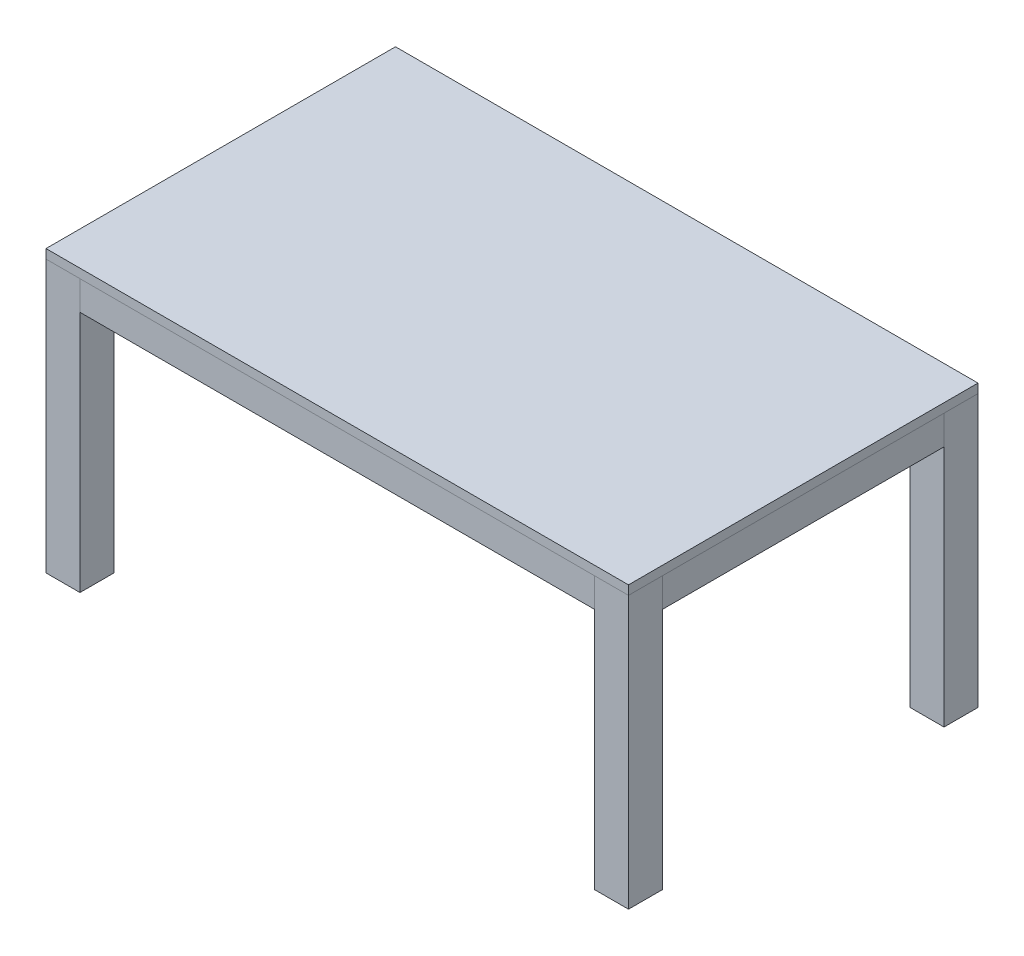
from build123d import *

# Parameters (mm, degrees)
SKETCH1_W             = 88.9
SKETCH1_H             = 88.9
BOSS_EXTRUDE1_DEPTH   = 711.2
BOSS_EXTRUDE1_2_DEPTH = 711.2
BOSS_EXTRUDE1_3_DEPTH = 711.2
BOSS_EXTRUDE1_4_DEPTH = 711.2
SKETCH2_W             = 1524
SKETCH2_H             = 914.4
BOSS_EXTRUDE2_DEPTH   = 23.8125
SKETCH3_W             = 19.05
SKETCH3_H             = 76.2
BOSS_EXTRUDE3_DEPTH   = 736.6
BOSS_EXTRUDE3_2_DEPTH = 736.6
SKETCH4_W             = 19.05
SKETCH4_H             = 76.2
BOSS_EXTRUDE4_DEPTH   = 1346.2
BOSS_EXTRUDE4_2_DEPTH = 1346.2
SKETCH6_R             = 6.985
CUT_EXTRUDE1_DEPTH    = 76.2


with BuildPart() as part:
    # Sketch1 → Boss-Extrude1 (new body)
    with BuildSketch(Plane(origin=(0, 0, 0), x_dir=(1, 0, 0), z_dir=(0, 1, 0))):
        with Locations((-717.55, 412.75)):
            Rectangle(SKETCH1_W, SKETCH1_H)
    extrude(amount=BOSS_EXTRUDE1_DEPTH)


with BuildPart() as body_2:
    # Sketch1 → Boss-Extrude1 2 (new body)
    with BuildSketch(Plane(origin=(0, 0, 0), x_dir=(1, 0, 0), z_dir=(0, 1, 0))):
        with Locations((717.55, 412.75)):
            Rectangle(SKETCH1_W, SKETCH1_H)
    extrude(amount=BOSS_EXTRUDE1_2_DEPTH)


with BuildPart() as body_3:
    # Sketch1 → Boss-Extrude1 3 (new body)
    with BuildSketch(Plane(origin=(0, 0, 0), x_dir=(1, 0, 0), z_dir=(0, 1, 0))):
        with Locations((717.55, -412.75)):
            Rectangle(SKETCH1_W, SKETCH1_H)
    extrude(amount=BOSS_EXTRUDE1_3_DEPTH)


with BuildPart() as body_4:
    # Sketch1 → Boss-Extrude1 4 (new body)
    with BuildSketch(Plane(origin=(0, 0, 0), x_dir=(1, 0, 0), z_dir=(0, 1, 0))):
        with Locations((-717.55, -412.75)):
            Rectangle(SKETCH1_W, SKETCH1_H)
    extrude(amount=BOSS_EXTRUDE1_4_DEPTH)


with BuildPart() as body_5:
    # Sketch2 → Boss-Extrude2 (new body)
    with BuildSketch(Plane(origin=(0, 711.2, 0), x_dir=(1, 0, 0), z_dir=(0, 1, 0))):
        Rectangle(SKETCH2_W, SKETCH2_H)
    extrude(amount=BOSS_EXTRUDE2_DEPTH)


with BuildPart() as body_6:
    # Sketch3 → Boss-Extrude3 (new body)
    with BuildSketch(Plane.XY.offset(-368.3)):
        with Locations((-752.475, 673.1)):
            Rectangle(SKETCH3_W, SKETCH3_H)
    extrude(amount=BOSS_EXTRUDE3_DEPTH)


with BuildPart() as body_7:
    # Sketch3 → Boss-Extrude3 2 (new body)
    with BuildSketch(Plane.XY.offset(-368.3)):
        with Locations((752.475, 673.1)):
            Rectangle(SKETCH3_W, SKETCH3_H)
    extrude(amount=BOSS_EXTRUDE3_2_DEPTH)


with BuildPart() as body_8:
    # Sketch4 → Boss-Extrude4 (new body)
    with BuildSketch(Plane(origin=(-673.1, 0, 0), x_dir=(0, 0, -1), z_dir=(1, 0, 0))):
        with Locations((-447.675, 673.1)):
            Rectangle(SKETCH4_W, SKETCH4_H)
    extrude(amount=BOSS_EXTRUDE4_DEPTH)


with BuildPart() as body_9:
    # Sketch4 → Boss-Extrude4 2 (new body)
    with BuildSketch(Plane(origin=(-673.1, 0, 0), x_dir=(0, 0, -1), z_dir=(1, 0, 0))):
        with Locations((447.675, 673.1)):
            Rectangle(SKETCH4_W, SKETCH4_H)
    extrude(amount=BOSS_EXTRUDE4_2_DEPTH)


with BuildPart() as cut_extrude1_tool:
    # Sketch6 → Cut-Extrude1 (new body)
    with BuildSketch(Plane.XZ):
        with Locations(Location((-717.55, 412.75, 0), (0, 0, 270))):
            Circle(SKETCH6_R)
        with Locations(Location((-717.55, -412.75, 0), (0, 0, 270))):
            Circle(SKETCH6_R)
        with Locations(Location((717.55, -412.75, 0), (0, 0, 270))):
            Circle(SKETCH6_R)
        with Locations(Location((717.55, 412.75, 0), (0, 0, 270))):
            Circle(SKETCH6_R)
    extrude(amount=-CUT_EXTRUDE1_DEPTH)


with BuildPart() as part_1:
    add(part.part)

    # Cut-Extrude1: cut by cut_extrude1_tool
    add(cut_extrude1_tool.part, mode=Mode.SUBTRACT)


with BuildPart() as body_2_1:
    add(body_2.part)

    # Cut-Extrude1: cut by cut_extrude1_tool
    add(cut_extrude1_tool.part, mode=Mode.SUBTRACT)


with BuildPart() as body_3_1:
    add(body_3.part)

    # Cut-Extrude1: cut by cut_extrude1_tool
    add(cut_extrude1_tool.part, mode=Mode.SUBTRACT)


with BuildPart() as body_4_1:
    add(body_4.part)

    # Cut-Extrude1: cut by cut_extrude1_tool
    add(cut_extrude1_tool.part, mode=Mode.SUBTRACT)


solid = Compound([body_5.part, body_6.part, body_7.part, body_8.part, body_9.part, part_1.part, body_2_1.part, body_3_1.part, body_4_1.part])
